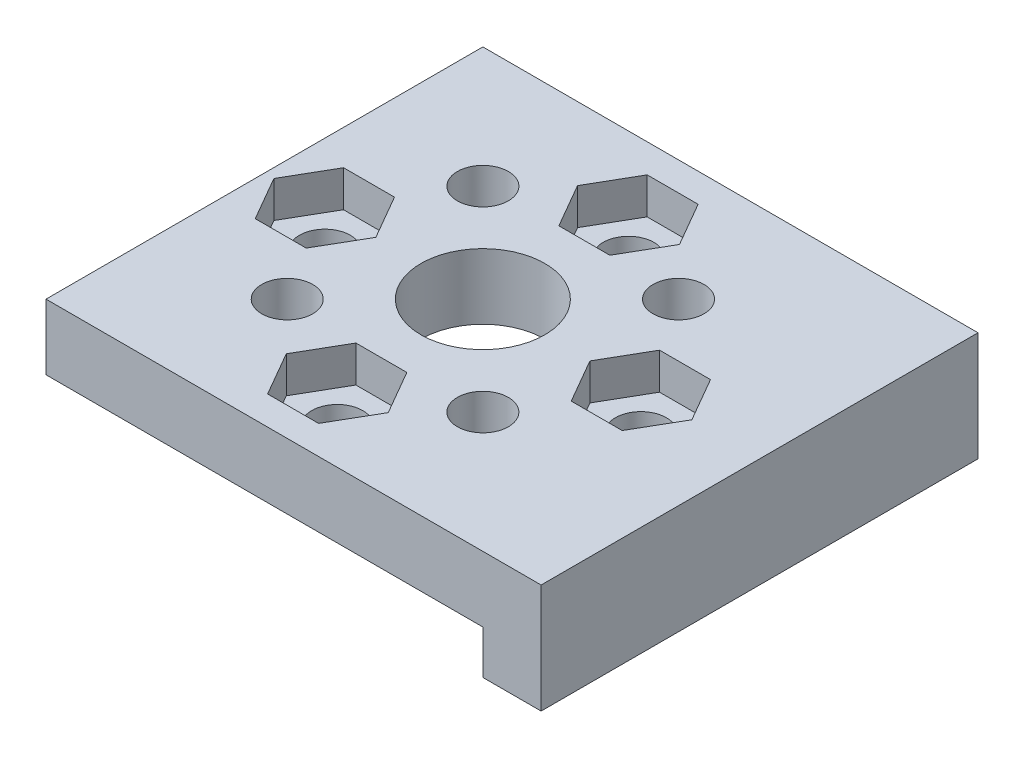
from build123d import *

# Parameters (mm, degrees)
SCHIZZO1_W                  = 30
SCHIZZO1_H                  = 30
SCHIZZO1_R                  = 1.75
SCHIZZO1_R_2                = 4.25
PIASTRAAGGANCIO_DEPTH       = 4.5
SCHIZZO4_W                  = 58
SCHIZZO4_H                  = 39
BASEESC_DEPTH               = 4
SCHIZZO5_W                  = 8
SCHIZZO5_H                  = 4
APERTURAFASCETTA_DEPTH      = 57.455734873
SCHIZZO8_R                  = 1.75
CHIUSURAFORIESAGONALI_DEPTH = 2
RIMOZIONEPIASTAESC_DEPTH    = 10


with BuildPart() as part:
    # Schizzo1 → PiastraAggancio (new body)
    with BuildSketch(Plane(origin=(0, 0, 0), x_dir=(1, 0, 0), z_dir=(0, 1, 0))):
        Rectangle(SCHIZZO1_W, SCHIZZO1_H)
        with Locations(Location((6.717514421, -6.717514421, 0), (0, 0, 270))):
            Circle(SCHIZZO1_R, mode=Mode.SUBTRACT)
        with Locations(Location((-6.717514421, -6.717514421, 0), (0, 0, 270))):
            Circle(SCHIZZO1_R, mode=Mode.SUBTRACT)
        with Locations(Location((-6.717514421, 6.717514421, 0), (0, 0, 270))):
            Circle(SCHIZZO1_R, mode=Mode.SUBTRACT)
        with Locations(Location((6.717514421, 6.717514421, 0), (0, 0, 270))):
            Circle(SCHIZZO1_R, mode=Mode.SUBTRACT)
        with Locations(Location((0, 0, 0), (0, 0, 270))):
            Circle(SCHIZZO1_R_2, mode=Mode.SUBTRACT)
        Polygon((12.6, -3.031088913), (14.35, 0), (12.6, 3.031088913), (9.1, 3.031088913), (7.35, 0), (9.1, -3.031088913), align=None, mode=Mode.SUBTRACT)
        Polygon((-3.5, -10), (-1.75, -13.031088913), (1.75, -13.031088913), (3.5, -10), (1.75, -6.968911087), (-1.75, -6.968911087), align=None, mode=Mode.SUBTRACT)
        Polygon((-14.35, 0), (-12.6, -3.031088913), (-9.1, -3.031088913), (-7.35, 0), (-9.1, 3.031088913), (-12.6, 3.031088913), align=None, mode=Mode.SUBTRACT)
        Polygon((1.75, 6.968911087), (3.5, 10), (1.75, 13.031088913), (-1.75, 13.031088913), (-3.5, 10), (-1.75, 6.968911087), align=None, mode=Mode.SUBTRACT)
    extrude(amount=PIASTRAAGGANCIO_DEPTH)

    # Schizzo4 → BaseESC (add)
    with BuildSketch(Plane(origin=(15, 0, 0), x_dir=(0, 0, -1), z_dir=(1, 0, 0))):
        with Locations((0, -15)):
            Rectangle(SCHIZZO4_W, SCHIZZO4_H)
    extrude(amount=BASEESC_DEPTH)

    # Schizzo5 → AperturaFascetta (cut, through all)
    with BuildSketch(Plane(origin=(19, 0, 0), x_dir=(0, 0, -1), z_dir=(1, 0, 0))):
        with Locations((-21, -0.5)):
            Rectangle(SCHIZZO5_W, SCHIZZO5_H)
        with Locations((21, -0.5)):
            Rectangle(SCHIZZO5_W, SCHIZZO5_H)
        with Locations((21, -29.5)):
            Rectangle(SCHIZZO5_W, SCHIZZO5_H)
        with Locations((-21, -29.5)):
            Rectangle(SCHIZZO5_W, SCHIZZO5_H)
    extrude(amount=-APERTURAFASCETTA_DEPTH, mode=Mode.SUBTRACT)

    # Schizzo7 → SvasaturaVitiInferiori (revolve, cut)
    with BuildSketch(Plane.XY.offset(6.717514421), mode=Mode.PRIVATE) as svasaturavitiinferiori_sk:
        Polygon((-9.217514421, 0), (-8.467514421, 2), (-6.717514421, 2), (-6.717514421, 0), align=None)
    svasaturavitiinferiori = revolve(svasaturavitiinferiori_sk.sketch.rotate(Axis((-6.717514421, 2, 6.717514421), (0, -1, 0)), 270), axis=Axis((-6.717514421, 2, 6.717514421), (0, -1, 0)), mode=Mode.SUBTRACT)

    # SvasaturaVitiInferiori2: SvasaturaVitiInferiori across plane
    add(svasaturavitiinferiori.mirror(Plane(origin=(0, 0, 0), x_dir=(0, 0, 1), z_dir=(1, 0, 0))), mode=Mode.SUBTRACT)

    # SvasaturaVitiInferiori3: SvasaturaVitiInferiori across plane
    add(svasaturavitiinferiori.mirror(Plane.XY), mode=Mode.SUBTRACT)

    # SvasaturaVitiInferiori3 copy 1 sketch → SvasaturaVitiInferiori3 copy 1 (revolve, cut)
    with BuildSketch(Plane(origin=(0, 0, -6.717514421), x_dir=(-1, 0, 0), z_dir=(0, 0, -1))):
        Polygon((-9.217514421, 0), (-8.467514421, 2), (-6.717514421, 2), (-6.717514421, 0), align=None)
    revolve(axis=Axis((6.717514421, 2, -6.717514421), (0, -1, 0)), mode=Mode.SUBTRACT)

    # Schizzo8 → ChiusuraForiEsagonali (add)
    # profile 1 of 4: a face of its own
    with BuildSketch(Plane.XZ):
        Polygon((1.75, -13.031088913), (3.5, -10), (1.75, -6.968911087), (-1.75, -6.968911087), (-3.5, -10), (-1.75, -13.031088913), align=None)
        with Locations(Location((0, -10, 0), (0, 0, 270))):
            Circle(SCHIZZO8_R, mode=Mode.SUBTRACT)
    # profile 2 of 4: a face of its own
    with BuildSketch(Plane.XZ):
        Polygon((12.6, 3.031088913), (9.1, 3.031088913), (7.35, 0), (9.1, -3.031088913), (12.6, -3.031088913), (14.35, 0), align=None)
        with Locations(Location((10.85, 0, 0), (0, 0, 270))):
            Circle(SCHIZZO8_R, mode=Mode.SUBTRACT)
    # profile 3 of 4: a face of its own
    with BuildSketch(Plane.XZ):
        Polygon((-1.75, 13.031088913), (-3.5, 10), (-1.75, 6.968911087), (1.75, 6.968911087), (3.5, 10), (1.75, 13.031088913), align=None)
        with Locations(Location((0, 10, 0), (0, 0, 270))):
            Circle(SCHIZZO8_R, mode=Mode.SUBTRACT)
    # profile 4 of 4: a face of its own
    with BuildSketch(Plane.XZ):
        Polygon((-14.35, 0), (-12.6, -3.031088913), (-9.1, -3.031088913), (-7.35, 0), (-9.1, 3.031088913), (-12.6, 3.031088913), align=None)
        with Locations(Location((-10.85, 0, 0), (0, 0, 270))):
            Circle(SCHIZZO8_R, mode=Mode.SUBTRACT)
    extrude(amount=-CHIUSURAFORIESAGONALI_DEPTH)

    # Schizzo9 → RimozionePiastaESC (cut)
    with BuildSketch(Plane.ZY.offset(-15)):
        Polygon((-15, 0), (-15, -3), (15, -3), (15, 0), (15, 4.5), (29, 4.5), (29, -34.5), (-29, -34.5), (-29, 4.5), (-15, 4.5), align=None)
    extrude(amount=-RIMOZIONEPIASTAESC_DEPTH, mode=Mode.SUBTRACT)


solid = part.part
